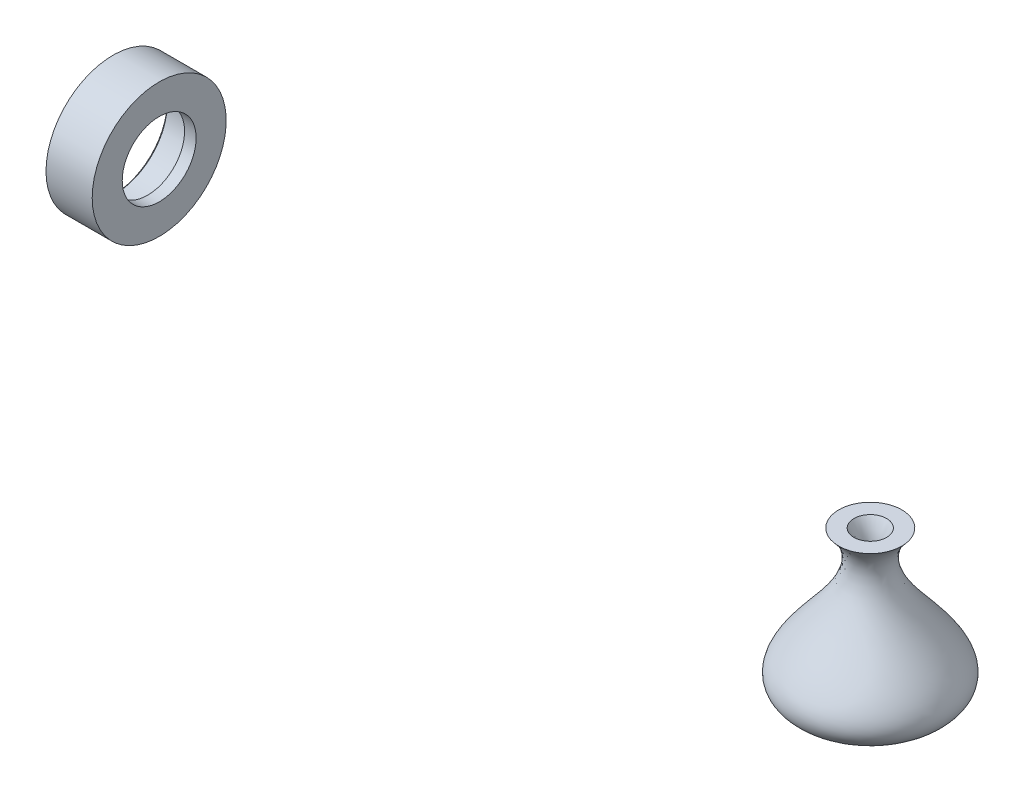
from build123d import *

# Parameters (mm, degrees)
CHAMFER_1_SIZE = 1


with BuildPart() as part:
    # 草图1 → 旋转1 (revolve)
    with BuildSketch(Plane.XY):
        with BuildLine():
            Line((-26.595370865, 45.877014743), (-12.965243297, 45.877014743))
            Line((-12.965243297, 45.877014743), (-12.965243297, -22.107402032))
            Line((-12.965243297, -22.107402032), (-21.774959896, -22.107402032))
            add(Edge.make_bspline(
                [(-26.595370865, 45.877014743), (-0.79666506, 20.580411041), (-85.246154667, -11.005701732), (-21.774959896, -22.107402032)],
                knots=[0, 0, 0, 0, 1, 1, 1, 1], degree=3))
        make_face()
    revolve(axis=Axis((-12.965243297, -22.107402032, 0), (0, 1, 0)))

    # 草图2 → 切除-旋转1 (revolve, cut)
    with BuildSketch(Plane.XY):
        with BuildLine():
            Line((-21.33685257, -17.107402032), (-12.965243297, -17.107402032))
            Line((-12.965243297, -17.107402032), (-12.965243297, 45.176601137))
            Line((-12.965243297, 45.176601137), (-12.965243297, 45.877014743))
            Line((-12.965243297, 45.877014743), (-15.079937913, 45.877014743))
            Line((-15.079937913, 45.877014743), (-20.050946276, 45.877014743))
            add(Edge.make_bspline(
                [(-20.050946276, 45.877014743), (-19.550092699, 45.15808437), (-19.082694604, 44.396653294), (-18.065882081, 42.448069869), (-17.568018156, 41.216451543), (-16.851866931, 38.653309297), (-16.635479489, 37.324605775), (-16.490180844, 34.692172894), (-16.559259119, 33.390767191), (-16.91197585, 30.891288816), (-17.19374796, 29.692309456), (-17.893163724, 27.407100616), (-18.310604377, 26.319742349), (-19.22912405, 24.239387784), (-19.730478684, 23.245959998), (-21.313284194, 20.375381767), (-22.470924152, 18.605669157), (-24.862928031, 15.230622799), (-26.099862655, 13.626150262), (-28.588631418, 10.509195003), (-29.841552488, 8.997271276), (-32.30829136, 6.019214188), (-33.523283885, 4.553037065), (-35.260517924, 2.366301479), (-35.825145688, 1.639587978), (-36.910093308, 0.189930887), (-37.430544042, -0.533162703), (-38.404330877, -1.971254233), (-38.85782556, -2.686654553), (-39.662779294, -4.092456136), (-40.014012489, -4.78370185), (-40.565865888, -6.093401153), (-40.764055532, -6.711392977), (-40.92491158, -7.510539933), (-40.956290903, -7.755037527), (-40.980879788, -8.193625915), (-40.974460454, -8.387318334), (-40.933649478, -8.736390668), (-40.899762009, -8.892321127), (-40.802536299, -9.198552263), (-40.738757399, -9.349882034), (-40.564347825, -9.672166644), (-40.453097754, -9.843030046), (-40.170702988, -10.204686784), (-39.999609939, -10.39495082), (-39.398493882, -10.978497512), (-38.880826757, -11.381755698), (-37.688110613, -12.154490491), (-37.014717804, -12.525057552), (-35.576226607, -13.219986812), (-34.810812538, -13.545081172), (-33.223877984, -14.152835912), (-32.402042598, -14.435715659), (-29.882187776, -15.230191934), (-28.131531206, -15.688289387), (-25.457022646, -16.299951348), (-24.556828639, -16.49113738), (-23.197090705, -16.761790819), (-22.742253978, -16.849314163), (-22.057942614, -16.976866822), (-21.829530531, -17.018755203), (-21.512788186, -17.075933319), (-21.424945598, -17.091691842), (-21.33685257, -17.107402032)],
                knots=[0.040556796, 0.040556796, 0.040556796, 0.040556796, 0.0625, 0.0625, 0.09375, 0.09375, 0.125, 0.125, 0.15625, 0.15625, 0.1875, 0.1875, 0.21875, 0.21875, 0.25, 0.25, 0.3125, 0.3125, 0.375, 0.375, 0.4375, 0.4375, 0.5, 0.5, 0.53125, 0.53125, 0.5625, 0.5625, 0.59375, 0.59375, 0.625, 0.625, 0.65625, 0.65625, 0.671875, 0.671875, 0.6875, 0.6875, 0.703125, 0.703125, 0.71875, 0.71875, 0.734375, 0.734375, 0.75, 0.75, 0.78125, 0.78125, 0.8125, 0.8125, 0.84375, 0.84375, 0.875, 0.875, 0.9375, 0.9375, 0.96875, 0.96875, 0.984375, 0.984375, 0.9921875, 0.9921875, 0.995189865, 0.995189865, 0.995189865, 0.995189865], degree=3))
        make_face()
    revolve(axis=Axis((-12.965243297, -17.107402032, 0), (0, 1, 0)), mode=Mode.SUBTRACT)


with BuildPart() as body_2:
    # 草图3 → 旋转2 (revolve)
    with BuildSketch(Plane.XY, mode=Mode.PRIVATE) as revolve_2_sk:
        Polygon((-340.805095673, 52.699663326), (-328.805095673, 52.699663326), (-328.805095673, 55.199663326), (-325.805095673, 55.199663326), (-325.805095673, 46.199663326), (-320.805095673, 46.199663326), (-320.805095673, 59.199663326), (-340.805095673, 59.199663326), align=None)
    revolve(revolve_2_sk.sketch.rotate(Axis((-386.410262995, 30.199663326, 0), (1, 0, 0)), 90), axis=Axis((-386.410262995, 30.199663326, 0), (1, 0, 0)))

    # 倒角1
    chamfer_1_edges = [body_2.edges().sort_by_distance(p)[0] for p in [
        (-340.805095673, 30.199663326, -22.5),
    ]]
    chamfer(chamfer_1_edges, length=CHAMFER_1_SIZE)


solid = Compound([part.part, body_2.part])
